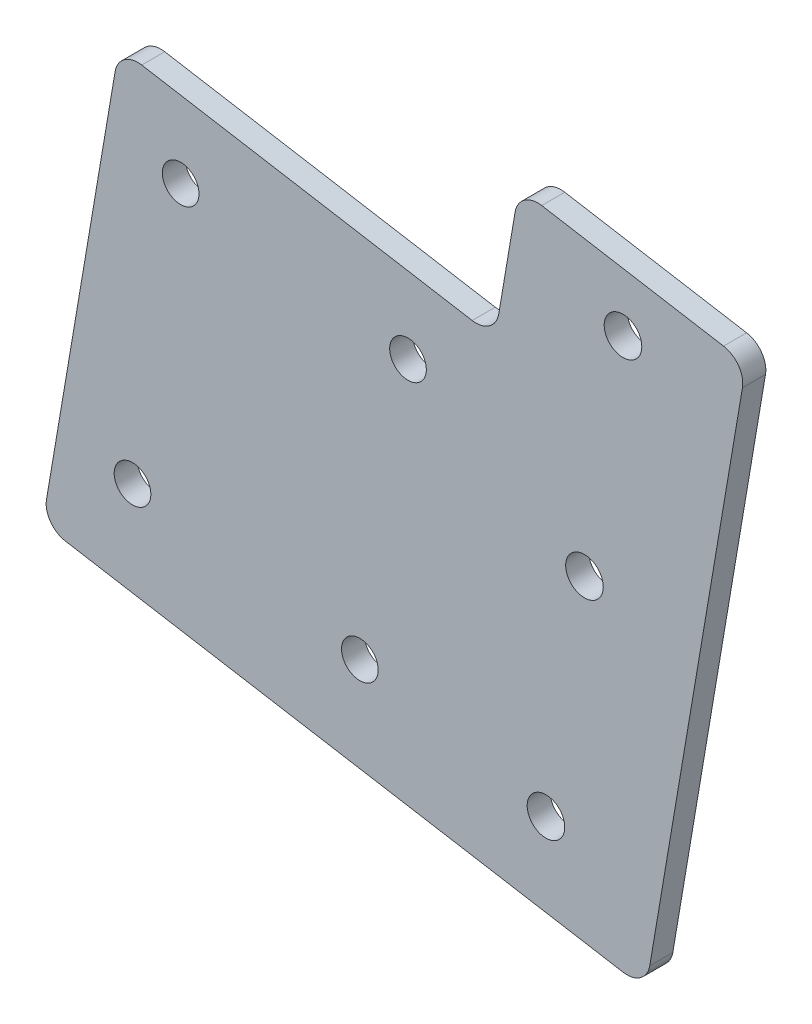
from build123d import *

# Parameters (mm, degrees)
SKETCH1_R           = 2.019299997
SKETCH1_R_2         = 2.019299996
SKETCH1_R_3         = 2.070099997
BOSS_EXTRUDE1_DEPTH = 2.54
FILLET2_R           = 2.54


with BuildPart() as part:
    # Sketch1 → Boss-Extrude1 (new body)
    with BuildSketch(Plane.XY):
        Polygon((-12.959899663, -36.98438298), (28.449865782, -44.000886797), (31.100646676, -28.356597569), (56.143695302, -32.599911782), (45.085639298, -97.861973534), (-21.367174772, -86.602155504), align=None)
        with Locations((-6.163136056, -46.554336191)):
            Circle(SKETCH1_R, mode=Mode.SUBTRACT)
        with Locations((-11.467278822, -77.858146974)):
            Circle(SKETCH1_R_2, mode=Mode.SUBTRACT)
        with Locations((18.87991257, -50.797650404)):
            Circle(SKETCH1_R_2, mode=Mode.SUBTRACT)
        with Locations((13.575769804, -82.101461187)):
            Circle(SKETCH1_R_2, mode=Mode.SUBTRACT)
        with Locations((38.318029948, -61.782055276)):
            Circle(SKETCH1_R_3, mode=Mode.SUBTRACT)
        with Locations((34.074715735, -86.825103902)):
            Circle(SKETCH1_R_3, mode=Mode.SUBTRACT)
        with Locations((42.561344161, -36.73900665)):
            Circle(SKETCH1_R_3, mode=Mode.SUBTRACT)
    extrude(amount=BOSS_EXTRUDE1_DEPTH)

    # Fillet2
    fillet2_edges = [part.edges().sort_by_distance(p)[0] for p in [
        (-21.367174772, -86.602155504, 1.27),
        (-12.959899663, -36.98438298, 1.27),
        (28.449865782, -44.000886797, 1.27),
        (31.100646676, -28.356597569, 1.27),
        (56.143695302, -32.599911782, 1.27),
        (45.085639298, -97.861973534, 1.27),
    ]]
    fillet(fillet2_edges, radius=FILLET2_R)


solid = part.part
